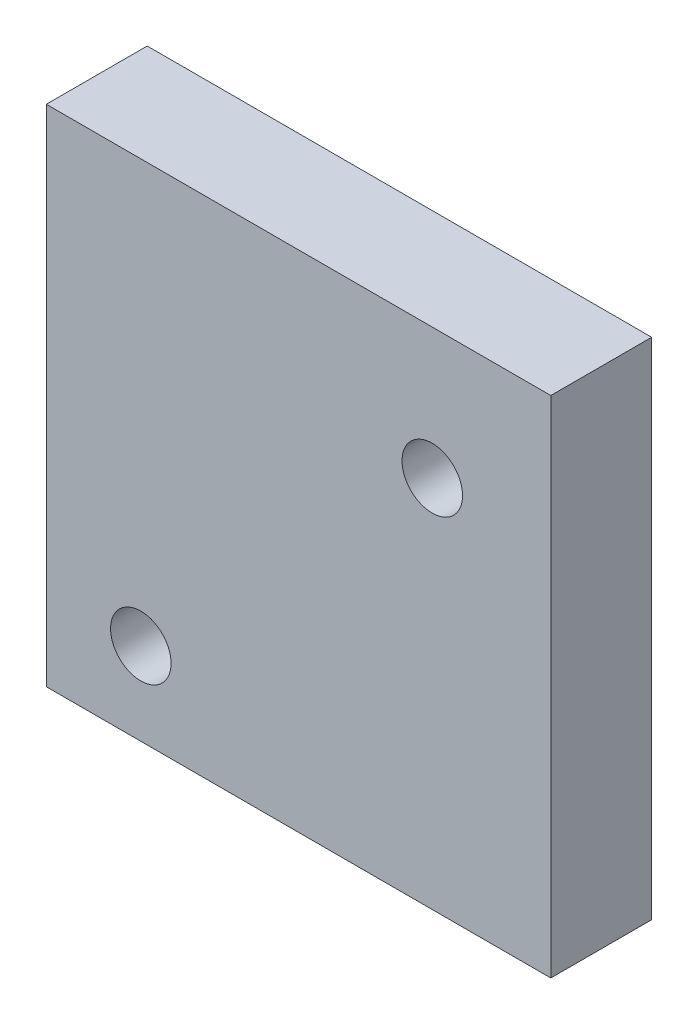
from build123d import *

# Parameters (mm, degrees)
SKETCH1_W                  = 100
SKETCH1_H                  = 100
BOSS_EXTRUDE1_DEPTH        = 20
F_12_0_12_DIAMETER_HOLE1_D = 12


with BuildPart() as part:
    # Sketch1 → Boss-Extrude1 (new body)
    with BuildSketch(Plane.XY):
        with Locations((50, 50)):
            Rectangle(SKETCH1_W, SKETCH1_H)
    extrude(amount=-BOSS_EXTRUDE1_DEPTH)

    # Ø12.0 (12) Diameter Hole1 (through all)
    with Locations(Plane.XY):
        with Locations((18.730975853, 16.360822488), (76.507609659, 74.058277502)):
            Hole(F_12_0_12_DIAMETER_HOLE1_D / 2)


solid = part.part
